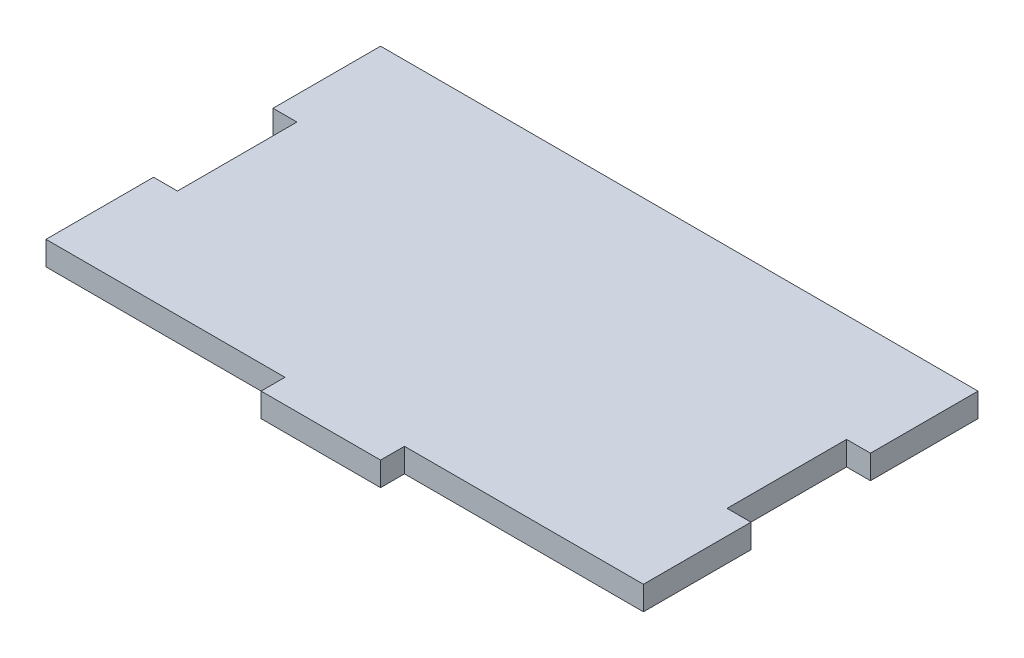
from build123d import *

# Parameters (mm, degrees)
SKETCH_1_W      = 92
SKETCH_1_H      = 56
SKETCH_1_W_2    = 4
SKETCH_1_H_2    = 18
SKETCH_1_W_3    = 20
SKETCH_1_H_3    = 4
EXTRUDE_1_DEPTH = 4


with BuildPart() as part:
    # 草图1 → 凸台-拉伸1 (new body)
    with BuildSketch(Plane(origin=(0, 0, 0), x_dir=(1, 0, 0), z_dir=(0, 1, 0))):
        with Locations((46, 28)):
            Rectangle(SKETCH_1_W, SKETCH_1_H)
        with Locations((-2, 9)):
            Rectangle(SKETCH_1_W_2, SKETCH_1_H_2)
        with Locations((-2, 47)):
            Rectangle(SKETCH_1_W_2, SKETCH_1_H_2)
        with Locations((46, -2)):
            Rectangle(SKETCH_1_W_3, SKETCH_1_H_3)
        with Locations((94, 9)):
            Rectangle(SKETCH_1_W_2, SKETCH_1_H_2)
        with Locations((94, 47)):
            Rectangle(SKETCH_1_W_2, SKETCH_1_H_2)
    extrude(amount=EXTRUDE_1_DEPTH)


solid = part.part
